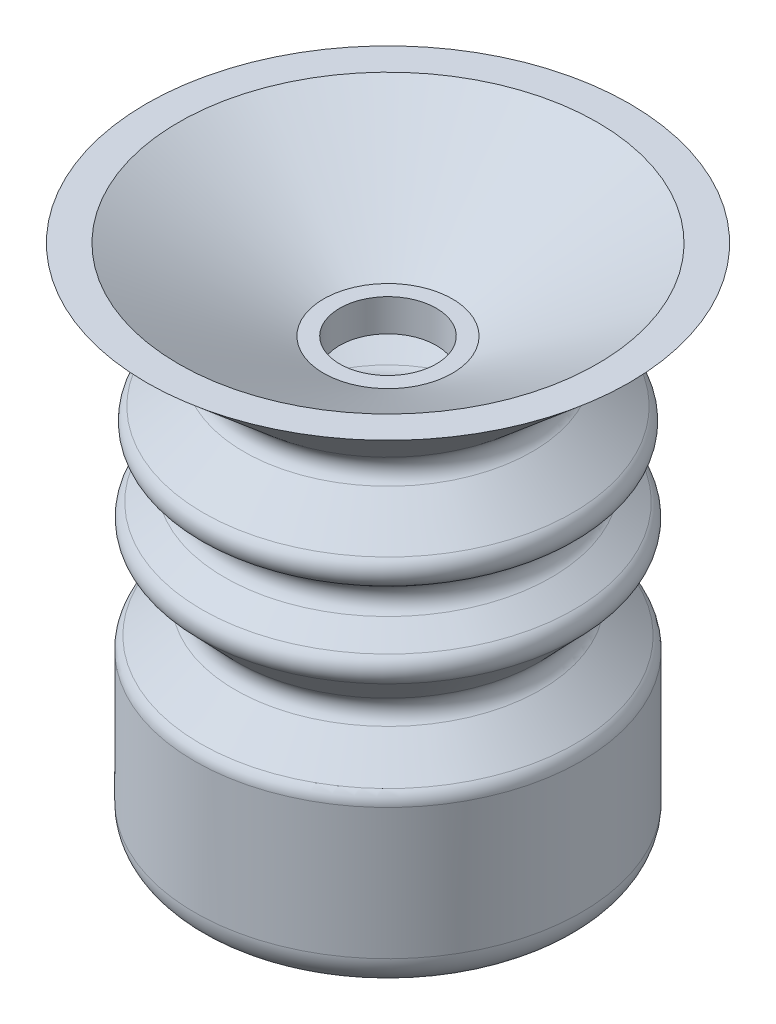
from build123d import *

# Parameters (mm, degrees)
CONG_1_R = 0.5
CONG_2_R = 1


with BuildPart() as part:
    # Esquisse1 → Révolution1 (revolve)
    with BuildSketch(Plane.XY, mode=Mode.PRIVATE) as r_volution1_sk:
        Polygon((2.5, 0), (2.5, 3), (3.5, 3), (3.5, 5), (2.5, 5), (2.5, 7.3), (4.529534947, 8.7), (2.839376944, 9.907255716), (4.649218941, 11.2), (3.024218941, 12.5), (1.5, 12.5), (1.5, 13.5), (2, 13.5), (6.5, 16), (7.5, 16), (4, 13), (6.25, 11.2), (4.5, 9.95), (6.25, 8.7), (4.33154497, 6.7), (6, 5.3), (6, 0), align=None)
    revolve(r_volution1_sk.sketch.rotate(Axis((0, 0, 0), (0, 1, 0)), 90), axis=Axis((0, 0, 0), (0, 1, 0)))

    # Congé1
    cong_1_edges = [part.edges().sort_by_distance(p)[0] for p in [
        (0, 5.3, 6),
        (0, 6.7, 4.33154497),
        (0, 8.7, 6.25),
        (0, 9.95, 4.5),
        (0, 11.2, 6.25),
        (0, 13, 4),
        (0, 11.2, 4.649218941),
        (0, 9.907255716, 2.839376944),
        (0, 8.7, 4.529534947),
        (0, 7.3, 2.5),
    ]]
    fillet(cong_1_edges, radius=CONG_1_R)

    # Congé2
    cong_2_edges = [part.edges().sort_by_distance(p)[0] for p in [
        (0, 0, 6),
    ]]
    fillet(cong_2_edges, radius=CONG_2_R)


solid = part.part
